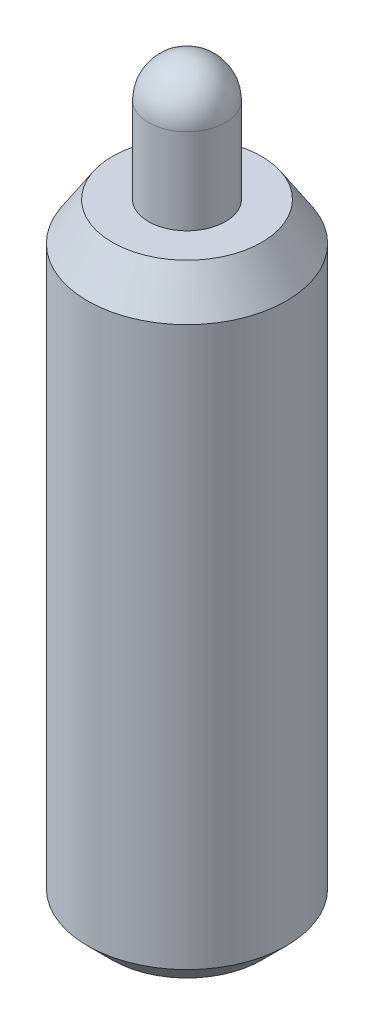
from build123d import *


with BuildPart() as part:
    # 草图1 → 旋转1 (revolve)
    with BuildSketch(Plane(origin=(0, 0, 0), x_dir=(0, 0, -1), z_dir=(1, 0, 0))):
        with BuildLine():
            Line((-3, 0), (-1.55, 0))
            Line((-1.55, 0), (-1.55, 3.45))
            ThreePointArc((-1.55, 3.45), (-1.096015511, 4.546015511), (0, 5))
            Line((0, 5), (0, -25))
            Line((0, -25), (-3, -25))
            Line((-3, -25), (-4, -24))
            Line((-4, -24), (-4, -1.536681018))
            Line((-4, -1.536681018), (-3, 0))
        make_face()
    revolve(axis=Axis((0, 46.298402486, 0), (0, -1, 0)))


solid = part.part
